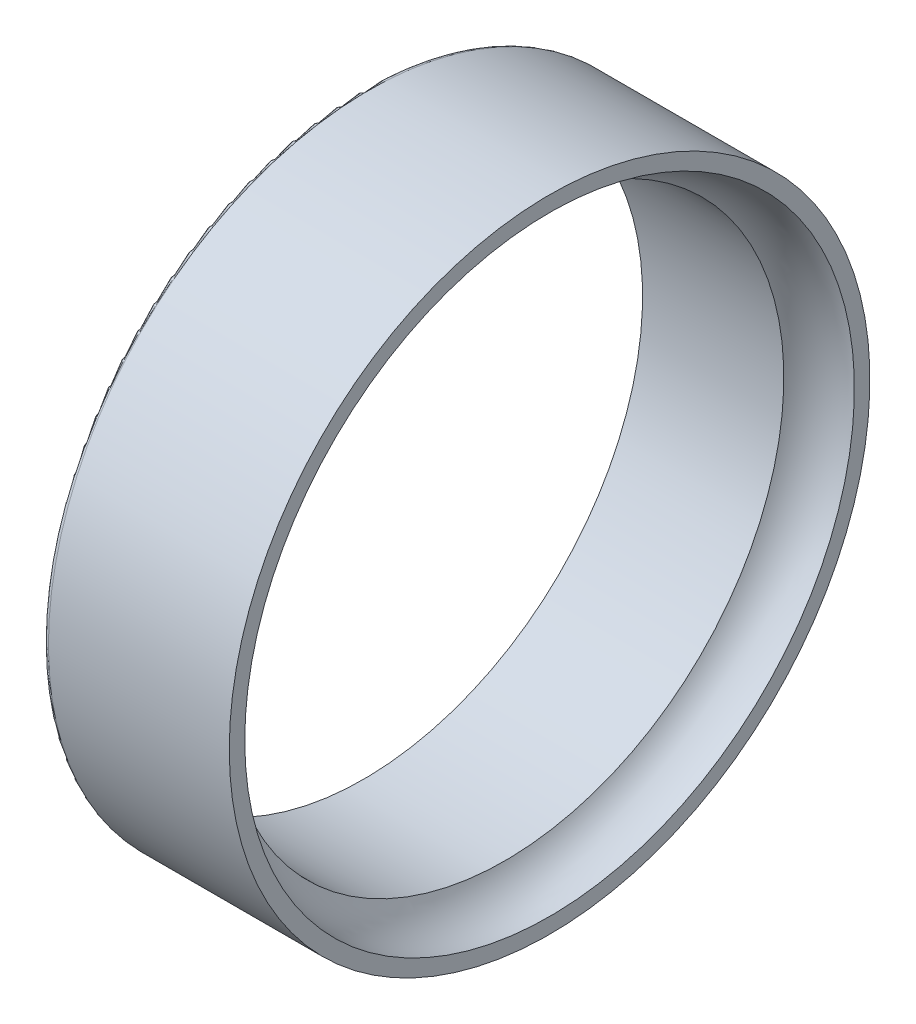
from build123d import *


with BuildPart() as part:
    # Esquisse1 → Base-Révolution (revolve)
    with BuildSketch(Plane.XY, mode=Mode.PRIVATE) as base_r_volution_sk:
        with BuildLine():
            Line((0, 27), (13.669872981, 27))
            ThreePointArc((13.669872981, 27), (15.5, 28.830127019), (18, 29.5))
            Line((18, 29.5), (18, 31))
            Line((18, 31), (0.5, 31))
            ThreePointArc((0.5, 31), (0.146446609, 30.853553391), (0, 30.5))
            Line((0, 30.5), (0, 27))
        make_face()
    revolve(base_r_volution_sk.sketch.rotate(Axis((-2.822263938, 0, 0), (1, 0, 0)), 90), axis=Axis((-2.822263938, 0, 0), (1, 0, 0)))


solid = part.part
